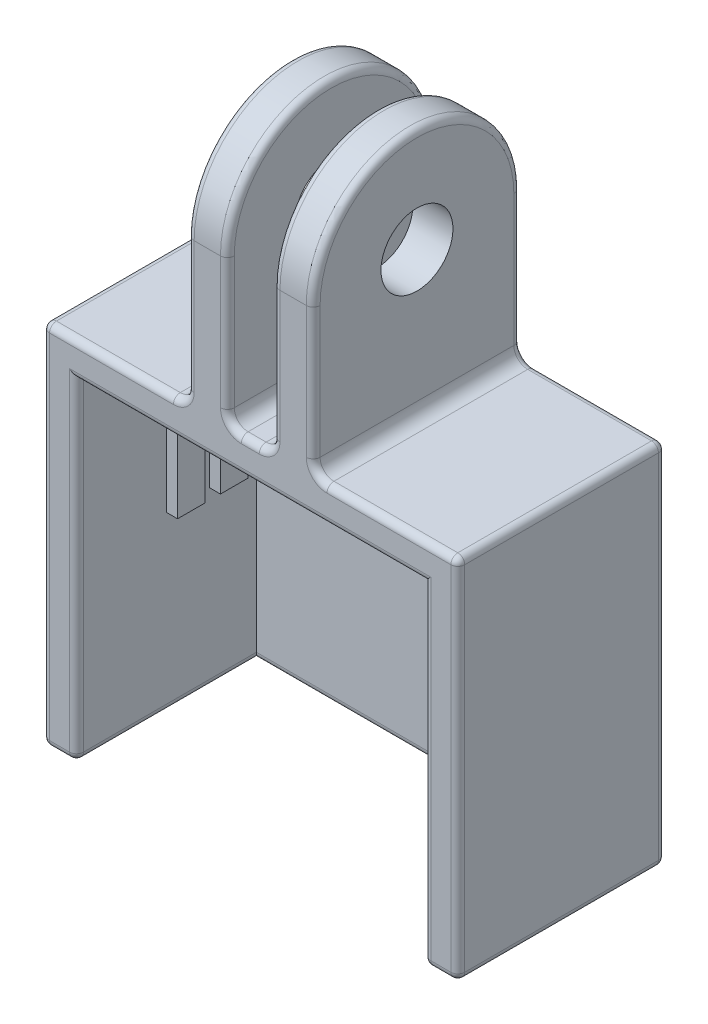
from build123d import *

# Parameters (mm, degrees)
SKETCH1_W             = 2.9
SKETCH1_H             = 18
BOSS_EXTRUDE1_DEPTH   = 15
BOSS_EXTRUDE1_2_DEPTH = 15
SKETCH2_R             = 2.6
CUT_EXTRUDE2_DEPTH    = 15
SKETCH3_W             = 30
SKETCH3_H             = 15
BOSS_EXTRUDE2_DEPTH   = 2.5
SKETCH4_W             = 2.45
SKETCH4_H             = 15
BOSS_EXTRUDE3_DEPTH   = 24
SKETCH5_W             = 25.1
SKETCH5_H             = 22
BOSS_EXTRUDE4_DEPTH   = 2
SKETCH6_W             = 0.8
SKETCH6_H             = 2
BOSS_EXTRUDE5_DEPTH   = 11.5
FILLET1_R             = 1
FILLET2_R             = 0.5


with BuildPart() as part:
    # Sketch1 → Boss-Extrude1 (new body)
    with BuildSketch(Plane.XY):
        with Locations((1.900000354, -27)):
            Rectangle(SKETCH1_W, SKETCH1_H)
    extrude(amount=-BOSS_EXTRUDE1_DEPTH)


with BuildPart() as body_2:
    # Sketch1 → Boss-Extrude1 2 (new body)
    with BuildSketch(Plane.XY):
        with Locations((8.100000354, -27)):
            Rectangle(SKETCH1_W, SKETCH1_H)
    extrude(amount=-BOSS_EXTRUDE1_2_DEPTH)


with BuildPart() as cut_extrude2_tool:
    # Sketch2 → Cut-Extrude2 (new body)
    with BuildSketch(Plane.ZY.offset(-0.450000354)):
        Polygon((-18.927806179, -18.044715247), (-15, -25.5), (-15, -18), (-7.5, -18), (0, -18), (0, -25.5), (4.387953652, -18.044715247), (4.387953652, -9.702474232), (-18.415606681, -11.446843021), align=None)
        with BuildLine():
            Line((-15, -18), (-15, -25.5))
            ThreePointArc((-15, -25.5), (-12.803300859, -20.196699141), (-7.5, -18))
            Line((-7.5, -18), (-15, -18))
        make_face()
        with BuildLine():
            ThreePointArc((-7.5, -18), (-2.196699141, -20.196699141), (0, -25.5))
            Line((0, -25.5), (0, -18))
            Line((0, -18), (-7.5, -18))
        make_face()
        with Locations(Location((-7.5, -25.5, 0), (0, 0, 270))):
            Circle(SKETCH2_R)
    extrude(amount=-CUT_EXTRUDE2_DEPTH)


with BuildPart() as part_1:
    add(part.part)

    # Cut-Extrude2: cut by cut_extrude2_tool
    add(cut_extrude2_tool.part, mode=Mode.SUBTRACT)



with BuildPart() as body_2_1:
    add(body_2.part)

    # Cut-Extrude2: cut by cut_extrude2_tool
    add(cut_extrude2_tool.part, mode=Mode.SUBTRACT)


with BuildPart() as part_2:
    add(part_1.part)

    add(body_2_1.part)  # Boss-Extrude2 merges body 2
    # Sketch3 → Boss-Extrude2 (add)
    with BuildSketch(Plane.XZ.offset(36)):
        with Locations((5.000000354, -7.5)):
            Rectangle(SKETCH3_W, SKETCH3_H)
    extrude(amount=BOSS_EXTRUDE2_DEPTH)

    # Sketch4 → Boss-Extrude3 (add)
    with BuildSketch(Plane.XZ.offset(38.5)):
        with Locations((-8.774999646, -7.5)):
            Rectangle(SKETCH4_W, SKETCH4_H)
        with Locations((18.775000354, -7.5)):
            Rectangle(SKETCH4_W, SKETCH4_H)
    extrude(amount=BOSS_EXTRUDE3_DEPTH)

    # Sketch5 → Boss-Extrude4 (add)
    with BuildSketch(Plane(origin=(0, 0, -15), x_dir=(-1, 0, 0), z_dir=(0, 0, -1))):
        with Locations((-5.000000354, -51.5)):
            Rectangle(SKETCH5_W, SKETCH5_H)
    extrude(amount=-BOSS_EXTRUDE4_DEPTH)

    # Sketch6 → Boss-Extrude5 (add)
    with BuildSketch(Plane.XZ.offset(38.5)):
        with Locations((-7.149999646, -7.5)):
            Rectangle(SKETCH6_W, SKETCH6_H)
        with Locations((-7.149999646, -10.6)):
            Rectangle(SKETCH6_W, SKETCH6_H)
        with Locations((17.150000354, -7.5)):
            Rectangle(SKETCH6_W, SKETCH6_H)
        with Locations((17.150000354, -10.6)):
            Rectangle(SKETCH6_W, SKETCH6_H)
    extrude(amount=BOSS_EXTRUDE5_DEPTH)

    # Fillet1
    fillet1_edges = [part_2.edges().sort_by_distance(p)[0] for p in [
        (6.650000354, -36, -7.5),
        (9.550000354, -36, -7.5),
        (3.350000354, -36, -7.5),
        (0.450000354, -36, -7.5),
    ]]
    fillet(fillet1_edges, radius=FILLET1_R)

    # Fillet2
    fillet2_edges = [part_2.edges().sort_by_distance(p)[0] for p in [
        (-7.549999646, -62.5, -6.5),
        (5.000000354, -62.5, -13),
        (5.000000354, -40.5, -13),
        (5.000000354, -40.5, -15),
        (0.450000354, -30.25, 0),
        (0.450000354, -30.25, -15),
        (-5.274999646, -36, 0),
        (5.000000354, -36, 0),
        (5.000000354, -36, -15),
        (3.350000354, -30.25, -15),
        (3.350000354, -30.25, 0),
        (15.275000354, -36, -15),
        (9.550000354, -30.25, -15),
        (9.550000354, -30.25, 0),
        (0.157107135, -35.707106781, 0),
        (0.157107135, -35.707106781, -15),
        (6.357107135, -35.707106781, 0),
        (6.357107135, -35.707106781, -15),
        (3.642893573, -35.707106781, 0),
        (3.642893573, -35.707106781, -15),
        (9.842893573, -35.707106781, 0),
        (9.842893573, -35.707106781, -15),
        (3.350000354, -18, -7.5),
        (0.450000354, -18, -7.5),
        (-9.999999646, -36, -7.5),
        (-9.999999646, -49.25, 0),
        (-5.274999646, -36, -15),
        (-9.999999646, -49.25, -15),
        (20.000000354, -36, -7.5),
        (20.000000354, -49.25, -15),
        (15.275000354, -36, 0),
        (20.000000354, -49.25, 0),
        (6.650000354, -18, -7.5),
        (6.650000354, -30.25, -15),
        (9.550000354, -18, -7.5),
        (6.650000354, -30.25, 0),
        (5.000000354, -38.5, -15),
        (-7.549999646, -50.5, 0),
        (-9.999999646, -62.5, -7.5),
        (5.000000354, -62.5, -15),
        (-8.774999646, -62.5, 0),
        (5.000000354, -38.5, 0),
        (17.550000354, -50.5, 0),
        (20.000000354, -62.5, -7.5),
        (18.775000354, -62.5, 0),
        (17.550000354, -62.5, -6.5),
    ]]
    fillet(fillet2_edges, radius=FILLET2_R)


solid = part_2.part
